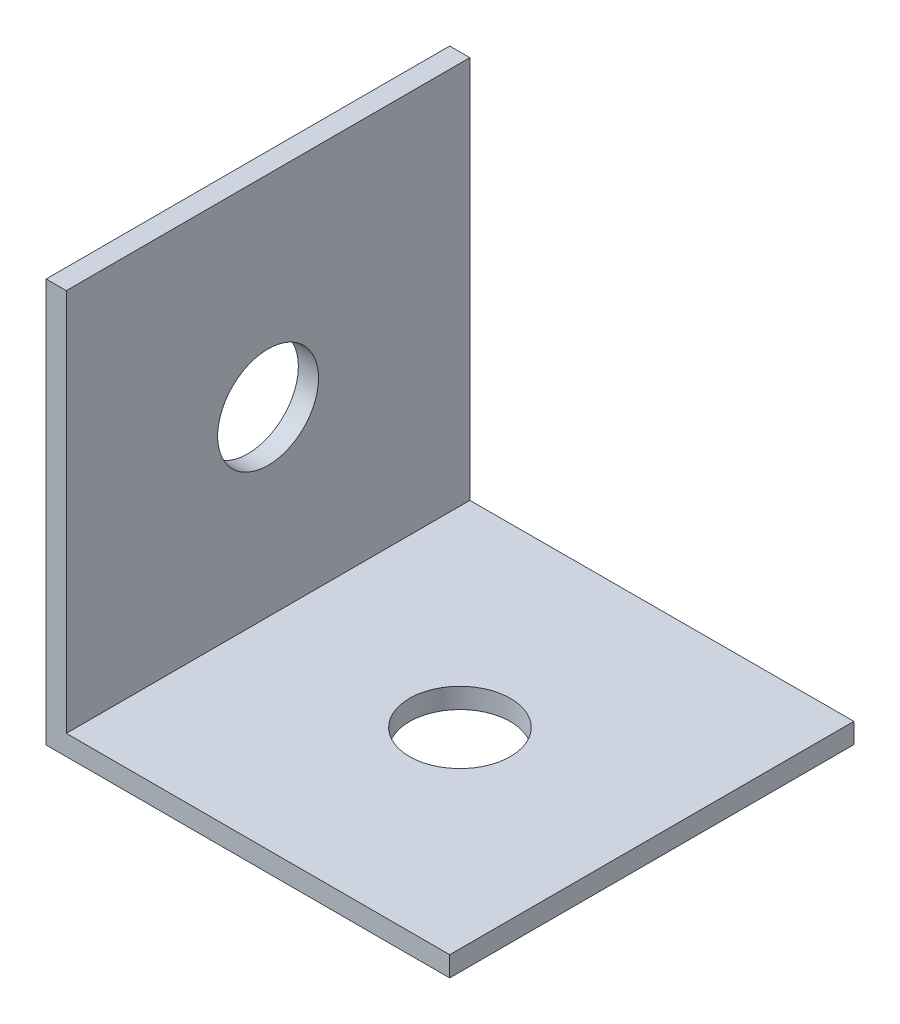
from build123d import *

# Parameters (mm, degrees)
SKETCH1_W           = 25.4
SKETCH1_H           = 25.4
BOSS_EXTRUDE1_DEPTH = 1.27
BOSS_EXTRUDE2_DEPTH = 1.27
SKETCH3_R           = 3.175
CUT_EXTRUDE1_DEPTH  = 1.27
SKETCH4_R           = 3.175
CUT_EXTRUDE2_DEPTH  = 1.27


with BuildPart() as part:
    # Sketch1 → Boss-Extrude1 (new body)
    with BuildSketch(Plane(origin=(0, 0, 0), x_dir=(0, 0, -1), z_dir=(1, 0, 0))):
        Rectangle(SKETCH1_W, SKETCH1_H)
    extrude(amount=BOSS_EXTRUDE1_DEPTH)

    # Sketch2 → Boss-Extrude2 (add)
    with BuildSketch(Plane.XZ.offset(12.7)):
        Polygon((1.27, 12.7), (25.4, 12.7), (25.4, -12.738650011), (1.27, -12.7), align=None)
    extrude(amount=-BOSS_EXTRUDE2_DEPTH)

    # Sketch3 → Cut-Extrude1 (cut)
    with BuildSketch(Plane(origin=(1.27, 0, 0), x_dir=(0, 0, -1), z_dir=(1, 0, 0))):
        Circle(SKETCH3_R)
    extrude(amount=-CUT_EXTRUDE1_DEPTH, mode=Mode.SUBTRACT)

    # Sketch4 → Cut-Extrude2 (cut)
    with BuildSketch(Plane(origin=(0, -11.43, 0), x_dir=(1, 0, 0), z_dir=(0, 1, 0))):
        with Locations(Location((13.335, 0.009662503, 0), (0, 0, 270))):
            Circle(SKETCH4_R)
    extrude(amount=-CUT_EXTRUDE2_DEPTH, mode=Mode.SUBTRACT)


solid = part.part
